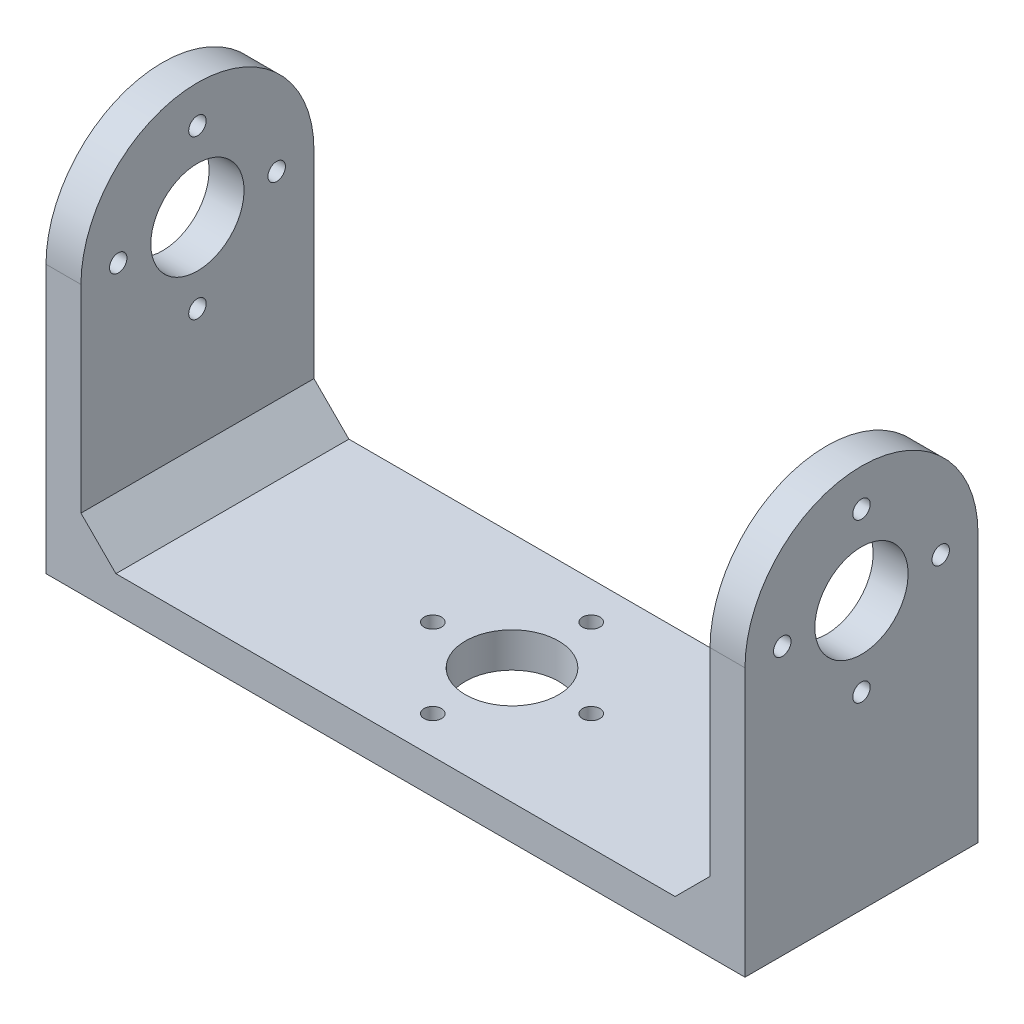
from build123d import *

# Parameters (mm, degrees)
SKETCH_1_W          = 60
SKETCH_1_H          = 20
EXTRUDE_1_DEPTH     = 3
EXTRUDE_2_DEPTH     = 3
EXTRUDE_START       = -3
EXTRUDE_3_DEPTH     = 3
SKETCH_4_R          = 4
SKETCH_4_R_2        = 0.75
CUT_EXTRUDE_1_DEPTH = 70.202601107
SKETCH_5_R          = 4
SKETCH_5_R_2        = 0.75
CUT_EXTRUDE_2_DEPTH = 3
CHAMFER_1_SIZE      = 3


with BuildPart() as part:
    # 草图1 → 凸台-拉伸1 (new body)
    with BuildSketch(Plane(origin=(0, 0, 0), x_dir=(1, 0, 0), z_dir=(0, 1, 0))):
        Rectangle(SKETCH_1_W, SKETCH_1_H)
    extrude(amount=EXTRUDE_1_DEPTH)

    # 草图2 → 凸台-拉伸2 (add)
    with BuildSketch(Plane(origin=(30, 0, 0), x_dir=(0, 0, -1), z_dir=(1, 0, 0))):
        with BuildLine():
            Line((-10, 3), (-10, 23))
            ThreePointArc((-10, 23), (0, 33), (10, 23))
            Line((10, 23), (10, 3))
            Line((10, 3), (-10, 3))
        make_face()
    extrude(amount=-EXTRUDE_2_DEPTH)

    # 草图3 → 凸台-拉伸3 (add)
    with BuildSketch(Plane.ZY.offset(30).offset(EXTRUDE_START)):
        with BuildLine():
            Line((-10, 3), (10, 3))
            Line((10, 3), (10, 23))
            ThreePointArc((10, 23), (0, 33), (-10, 23))
            Line((-10, 23), (-10, 3))
        make_face()
    extrude(amount=EXTRUDE_3_DEPTH)

    # 草图4 → 切除-拉伸1 (cut, through all)
    with BuildSketch(Plane.ZY.offset(30)):
        with Locations((0, 23)):
            Circle(SKETCH_4_R)
        with Locations((0, 29.8)):
            Circle(SKETCH_4_R_2)
        with Locations((6.8, 23)):
            Circle(SKETCH_4_R_2)
        with Locations((0, 16.2)):
            Circle(SKETCH_4_R_2)
        with Locations((-6.8, 23)):
            Circle(SKETCH_4_R_2)
    extrude(amount=-CUT_EXTRUDE_1_DEPTH, mode=Mode.SUBTRACT)

    # 草图5 → 切除-拉伸2 (cut)
    with BuildSketch(Plane(origin=(0, 3, 0), x_dir=(1, 0, 0), z_dir=(0, 1, 0))):
        with Locations(Location((0, 0, 0), (0, 0, 270))):
            Circle(SKETCH_5_R)
        with Locations(Location((0, 6.8, 0), (0, 0, 270))):
            Circle(SKETCH_5_R_2)
        with Locations(Location((6.8, 0, 0), (0, 0, 270))):
            Circle(SKETCH_5_R_2)
        with Locations(Location((0, -6.8, 0), (0, 0, 270))):
            Circle(SKETCH_5_R_2)
        with Locations(Location((-6.8, 0, 0), (0, 0, 270))):
            Circle(SKETCH_5_R_2)
    extrude(amount=-CUT_EXTRUDE_2_DEPTH, mode=Mode.SUBTRACT)

    # 倒角1
    chamfer_1_edges = [part.edges().sort_by_distance(p)[0] for p in [
        (27, 3, 0),
        (-27, 3, 0),
    ]]
    chamfer(chamfer_1_edges, length=CHAMFER_1_SIZE)


solid = part.part
